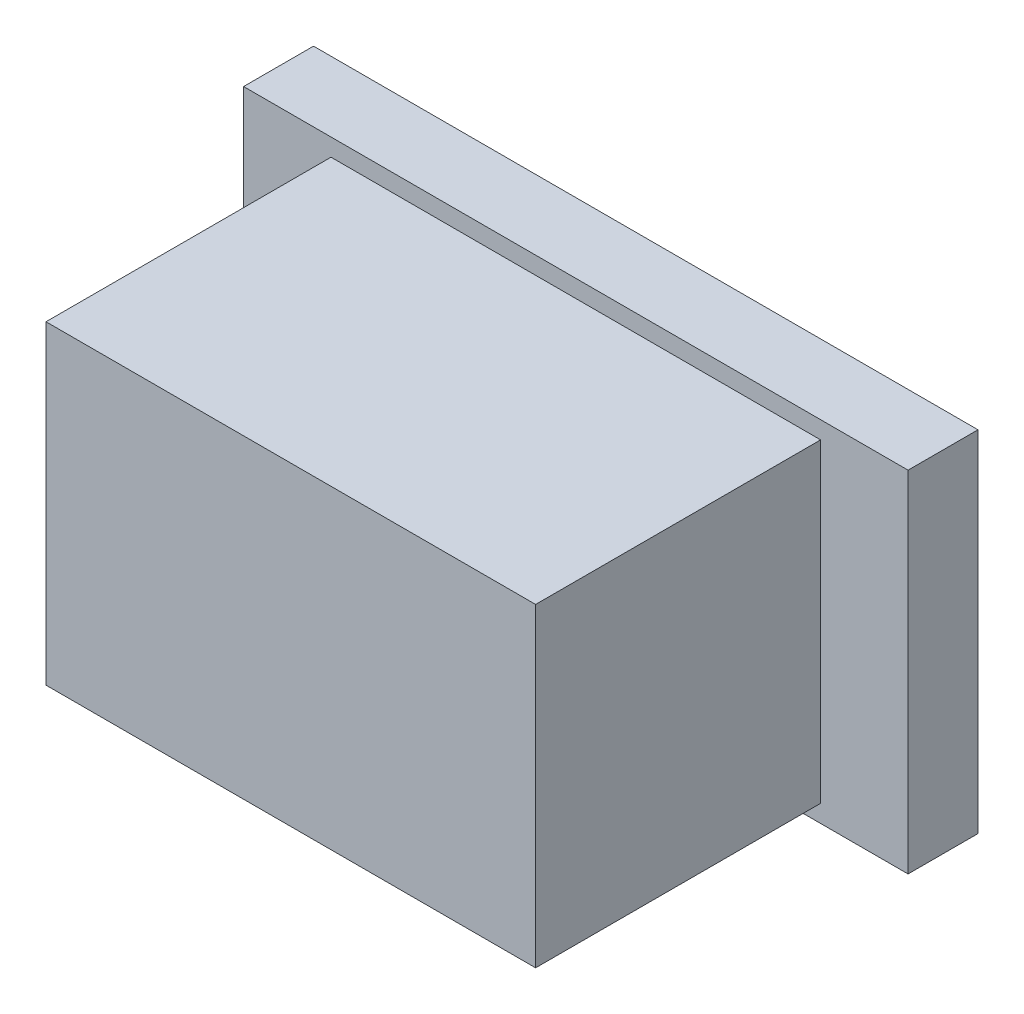
from build123d import *

# Parameters (mm, degrees)
SKETCH_1_W   = 7.6
SKETCH_1_H   = 4
FLANGE_DEPTH = 0.8
SKETCH_2_W   = 5.6
SKETCH_2_H   = 3.6
HEAD_DEPTH   = 4.06


with BuildPart() as part:
    # 草圖1 → flange (new body)
    with BuildSketch(Plane.XY):
        Rectangle(SKETCH_1_W, SKETCH_1_H)
    extrude(amount=FLANGE_DEPTH)

    # 草圖2 → head (add)
    with BuildSketch(Plane.XY):
        Rectangle(SKETCH_2_W, SKETCH_2_H)
    extrude(amount=HEAD_DEPTH)


solid = part.part
